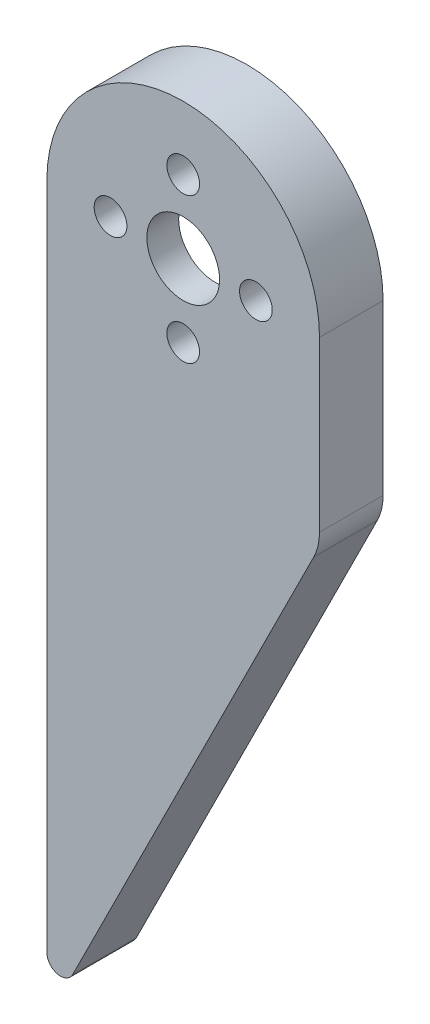
from build123d import *

# Parameters (mm, degrees)
ESQUISSE1_R             = 15
ESQUISSE1_R_2           = 1.8
ESQUISSE1_R_3           = 4
BOSS_EXTRU_1_DEPTH      = 7
CONG_1_R                = 1.5
CONG_2_R                = 6
ESQUISSE3_R             = 12
ENL_V_MAT_EXTRU_2_DEPTH = 3.5


with BuildPart() as part:
    # Esquisse1 → Boss.-Extru.1 (new body)
    # profile 1 of 2: a face of its own
    with BuildSketch(Plane.XY):
        with BuildLine():
            ThreePointArc((15, 0), (0, -15), (-15, 0))
            Line((-15, 0), (-15, -80))
            Line((-15, -80), (15, -20))
            Line((15, -20), (15, 0))
        make_face()
    # profile 2 of 2: a face of its own
    with BuildSketch(Plane.XY):
        Circle(ESQUISSE1_R)
        with Locations((-8, 0)):
            Circle(ESQUISSE1_R_2, mode=Mode.SUBTRACT)
        with Locations((0, -8)):
            Circle(ESQUISSE1_R_2, mode=Mode.SUBTRACT)
        with Locations((8, 0)):
            Circle(ESQUISSE1_R_2, mode=Mode.SUBTRACT)
        with Locations((0, 8)):
            Circle(ESQUISSE1_R_2, mode=Mode.SUBTRACT)
        Circle(ESQUISSE1_R_3, mode=Mode.SUBTRACT)
    extrude(amount=BOSS_EXTRU_1_DEPTH)

    # Congé1
    cong_1_edges = [part.edges().sort_by_distance(p)[0] for p in [
        (-15, -80, 3.5),
    ]]
    fillet(cong_1_edges, radius=CONG_1_R)

    # Congé2
    cong_2_edges = [part.edges().sort_by_distance(p)[0] for p in [
        (15, -20, 3.5),
    ]]
    fillet(cong_2_edges, radius=CONG_2_R)

    # Esquisse3 → Enlèv. mat.-Extru.2 (cut)
    with BuildSketch(Plane(origin=(0, 0, 0), x_dir=(-1, 0, 0), z_dir=(0, 0, -1))):
        Circle(ESQUISSE3_R)
    extrude(amount=-ENL_V_MAT_EXTRU_2_DEPTH, mode=Mode.SUBTRACT)


solid = part.part
